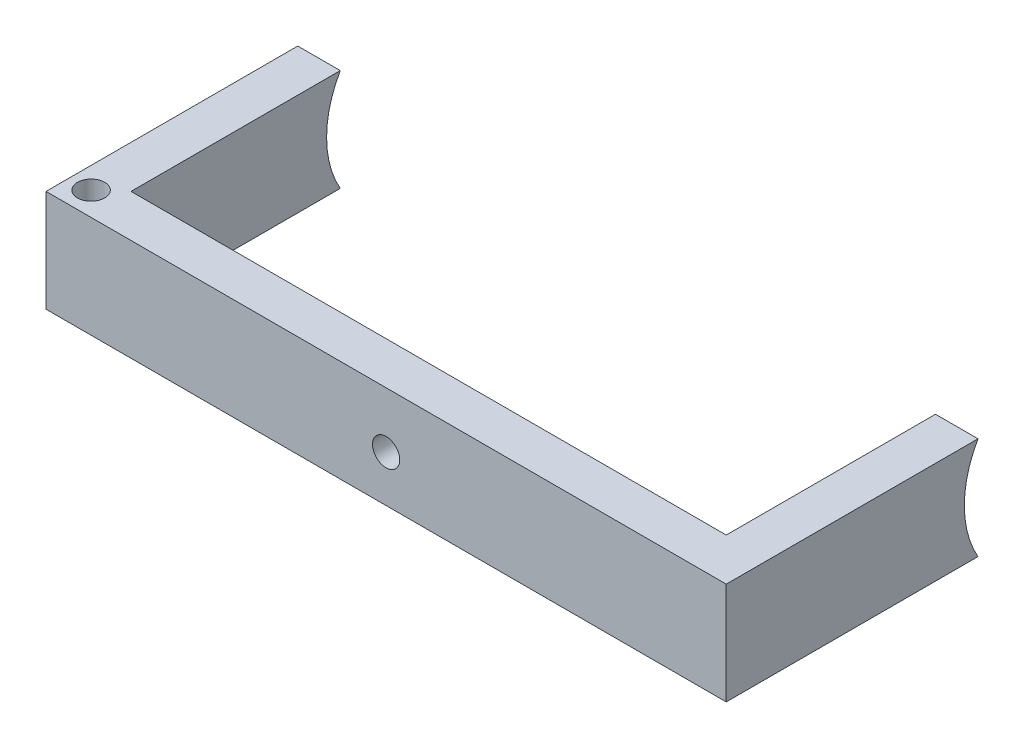
from build123d import *

# Parameters (mm, degrees)
SKETCH1_W                = 200
SKETCH1_H                = 200
BOSS_EXTRUDE1_DEPTH      = 30
SKETCH4_W                = 175
SKETCH4_H                = 175
CUT_EXTRUDE1_DEPTH       = 30
SKETCH7_R                = 4
CUT_EXTRUDE2_DEPTH       = 210
SKETCH10_W               = 6.040230253
SKETCH10_H               = 30
BOSS_EXTRUDE2_DEPTH      = 20
SKETCH11_W               = 10
SKETCH11_H               = 30
BOSS_EXTRUDE3_DEPTH      = 20
CUT_EXTRUDE3_START       = -231
SKETCH12_R               = 4
CUT_EXTRUDE3_DEPTH       = 231
SKETCH13_R               = 4
CUT_EXTRUDE5_DEPTH       = 231
SKETCH14_R               = 4
CUT_EXTRUDE6_DEPTH       = 250.5
SKETCH15_R               = 30
SKETCH15_R_2             = 22
BOSS_EXTRUDE5_DEPTH      = 201
SKETCH17_R               = 22
CUT_EXTRUDE7_DEPTH       = 201
SKETCH21_W               = 9.5
SKETCH21_H               = 28.855904386
BOSS_EXTRUDE6_DEPTH      = 26
SKETCH22_W               = 9.5
SKETCH22_H               = 6.040230253
CUT_EXTRUDE10_DEPTH      = 49
SKETCH23_W               = 10.008922512
SKETCH23_H               = 28.855904386
BOSS_EXTRUDE7_DEPTH      = 21
SKETCH24_W               = 9.5
SKETCH24_H               = 1.144095614
CUT_EXTRUDE11_DEPTH      = 27
SKETCH26_W               = 0.50137975
SKETCH26_H               = 20.893624798
CUT_EXTRUDE12_DEPTH      = 35
SKETCH27_R               = 49.192783102
CUT_EXTRUDE13_DEPTH      = 175
SKETCH28_R               = 41.209023923
CUT_EXTRUDE14_DEPTH      = 175
SKETCH31_R               = 25.671187695
CUT_EXTRUDE15_DEPTH      = 175
CUT_EXTRUDE16_DEPTH      = 246.814971066
CUT_EXTRUDE16_DEPTH_BACK = 220


with BuildPart() as part:
    # Sketch1 → Boss-Extrude1 (new body)
    with BuildSketch(Plane(origin=(0, 0, 0), x_dir=(1, 0, 0), z_dir=(0, 1, 0))):
        Rectangle(SKETCH1_W, SKETCH1_H)
    extrude(amount=BOSS_EXTRUDE1_DEPTH)

    # Sketch4 → Cut-Extrude1 (cut)
    with BuildSketch(Plane(origin=(0, 30, 0), x_dir=(1, 0, 0), z_dir=(0, 1, 0))):
        Rectangle(SKETCH4_W, SKETCH4_H)
    extrude(amount=-CUT_EXTRUDE1_DEPTH, mode=Mode.SUBTRACT)

    # Sketch7 → Cut-Extrude2 (cut)
    with BuildSketch(Plane.ZY.offset(100)):
        with Locations((0, 15)):
            Circle(SKETCH7_R)
    extrude(amount=-CUT_EXTRUDE2_DEPTH, mode=Mode.SUBTRACT)

    # Sketch10 → Boss-Extrude2 (add)
    with BuildSketch(Plane.ZY.offset(100)):
        with Locations((-11.64671233, 15)):
            Rectangle(SKETCH10_W, SKETCH10_H)
    extrude(amount=BOSS_EXTRUDE2_DEPTH)

    # Sketch11 → Boss-Extrude3 (add)
    with BuildSketch(Plane.XY.offset(-8.626597203)):
        with Locations((-115, 15)):
            Rectangle(SKETCH11_W, SKETCH11_H)
    extrude(amount=BOSS_EXTRUDE3_DEPTH)

    # Sketch12 → Cut-Extrude3 (cut)
    with BuildSketch(Plane(origin=(100, 0, 0), x_dir=(0, 0, -1), z_dir=(1, 0, 0)).offset(CUT_EXTRUDE3_START)):
        with Locations(Location((0, 15, 0), (0, 0, 180))):
            Circle(SKETCH12_R)
    extrude(amount=CUT_EXTRUDE3_DEPTH, mode=Mode.SUBTRACT)

    # Sketch13 → Cut-Extrude5 (cut)
    with BuildSketch(Plane(origin=(0, 30, 0), x_dir=(1, 0, 0), z_dir=(0, 1, 0))):
        with Locations(Location((-93.69452155, -93.045501349, 0), (0, 0, 270))):
            Circle(SKETCH13_R)
    extrude(amount=-CUT_EXTRUDE5_DEPTH, mode=Mode.SUBTRACT)

    # Sketch14 → Cut-Extrude6 (cut)
    with BuildSketch(Plane.XY.offset(100)):
        with Locations((0, 13.614739596)):
            Circle(SKETCH14_R)
    extrude(amount=-CUT_EXTRUDE6_DEPTH, mode=Mode.SUBTRACT)

    # Sketch15 → Boss-Extrude5 (add)
    with BuildSketch(Plane(origin=(100, 0, 0), x_dir=(0, 0, -1), z_dir=(1, 0, 0))):
        with Locations((0, 15)):
            Circle(SKETCH15_R)
        with Locations((0, 15)):
            Circle(SKETCH15_R_2, mode=Mode.SUBTRACT)
    extrude(amount=-BOSS_EXTRUDE5_DEPTH)

    # Sketch17 → Cut-Extrude7 (cut)
    with BuildSketch(Plane(origin=(100, 0, 0), x_dir=(0, 0, -1), z_dir=(1, 0, 0))):
        with Locations((0.074377339, 15.100772812)):
            Circle(SKETCH17_R)
    extrude(amount=-CUT_EXTRUDE7_DEPTH, mode=Mode.SUBTRACT)


with BuildPart() as cut_extrude7_piece_1:
    # of the separate pieces the step leaves, piece 1, a body of its own (cut_extrude7_pieces)
    add(part.part.solids().sort_by_distance((-100, 0, -100))[0])



with BuildPart() as cut_extrude7_piece_2:
    # of the separate pieces the step leaves, piece 2, a body of its own (cut_extrude7_pieces)
    add(part.part.solids().sort_by_distance((-101, 0, -14.666827456))[0])

    # Sketch21 → Boss-Extrude6 (add)
    with BuildSketch(Plane(origin=(0, 0, -14.666827456), x_dir=(-1, 0, 0), z_dir=(0, 0, -1))):
        with Locations((115.25, 15.572047807)):
            Rectangle(SKETCH21_W, SKETCH21_H)
    extrude(amount=BOSS_EXTRUDE6_DEPTH)

    # Sketch22 → Cut-Extrude10 (cut)
    with BuildSketch(Plane(origin=(0, 30, 0), x_dir=(1, 0, 0), z_dir=(0, 1, 0))):
        with Locations((-105.75, 11.64671233)):
            Rectangle(SKETCH22_W, SKETCH22_H)
    extrude(amount=-CUT_EXTRUDE10_DEPTH, mode=Mode.SUBTRACT)


with BuildPart() as cut_extrude7_piece_1_1:
    add(cut_extrude7_piece_1.part)

    add(cut_extrude7_piece_2.part)  # Boss-Extrude7 merges Cut-Extrude7 piece 2
    # Sketch23 → Boss-Extrude7 (add)
    with BuildSketch(Plane(origin=(-110.5, 0, 0), x_dir=(0, 0, -1), z_dir=(1, 0, 0))):
        with Locations((35.6623662, 15.572047807)):
            Rectangle(SKETCH23_W, SKETCH23_H)
    extrude(amount=BOSS_EXTRUDE7_DEPTH)

    # Sketch24 → Cut-Extrude11 (cut)
    with BuildSketch(Plane(origin=(0, 0, -14.666827456), x_dir=(-1, 0, 0), z_dir=(0, 0, -1))):
        with Locations((115.25, 0.572047807)):
            Rectangle(SKETCH24_W, SKETCH24_H)
    extrude(amount=-CUT_EXTRUDE11_DEPTH, mode=Mode.SUBTRACT)

    # Sketch26 → Cut-Extrude12 (cut)
    with BuildSketch(Plane.XZ):
        with Locations((-110.249310125, 1.820215196)):
            Rectangle(SKETCH26_W, SKETCH26_H)
    extrude(amount=-CUT_EXTRUDE12_DEPTH, mode=Mode.SUBTRACT)

    # Sketch27 → Cut-Extrude13 (cut)
    with BuildSketch(Plane(origin=(-87.5, 0, 0), x_dir=(0, 0, -1), z_dir=(1, 0, 0))):
        with Locations((-31.916352411, 15.376133278)):
            Circle(SKETCH27_R)
    extrude(amount=CUT_EXTRUDE13_DEPTH, mode=Mode.SUBTRACT)

    # Sketch28 → Cut-Extrude14 (cut)
    with BuildSketch(Plane(origin=(-87.5, 0, 0), x_dir=(0, 0, -1), z_dir=(1, 0, 0))):
        with Locations((37.762434774, 15.494435184)):
            Circle(SKETCH28_R)
    extrude(amount=CUT_EXTRUDE14_DEPTH, mode=Mode.SUBTRACT)

    # Sketch31 → Cut-Extrude15 (cut)
    with BuildSketch(Plane(origin=(-87.5, 0, 0), x_dir=(0, 0, -1), z_dir=(1, 0, 0))):
        with Locations((-2.206126603, -10.850671417)):
            Circle(SKETCH31_R)
    extrude(amount=CUT_EXTRUDE15_DEPTH, mode=Mode.SUBTRACT)

    # Sketch32 → Cut-Extrude16 (cut, two sides: drawn at the far end of the back side and taken through both)
    with BuildSketch(Plane(origin=(100, 0, 0), x_dir=(0, 0, -1), z_dir=(1, 0, 0)).offset(-CUT_EXTRUDE16_DEPTH_BACK)):
        with BuildLine():
            Line((112.795739645, 270.367951942), (-25.980762114, 30))
            ThreePointArc((-25.980762114, 30), (-30, 15), (-25.980762114, 0))
            Line((-25.980762114, 0), (112.795739645, -240.367951942))
            Line((112.795739645, -240.367951942), (667.901746678, -240.367951942))
            Line((667.901746678, -240.367951942), (667.901746678, 270.367951942))
            Line((667.901746678, 270.367951942), (112.795739645, 270.367951942))
        make_face()
    extrude(amount=CUT_EXTRUDE16_DEPTH + CUT_EXTRUDE16_DEPTH_BACK, mode=Mode.SUBTRACT)


solid = cut_extrude7_piece_1_1.part
